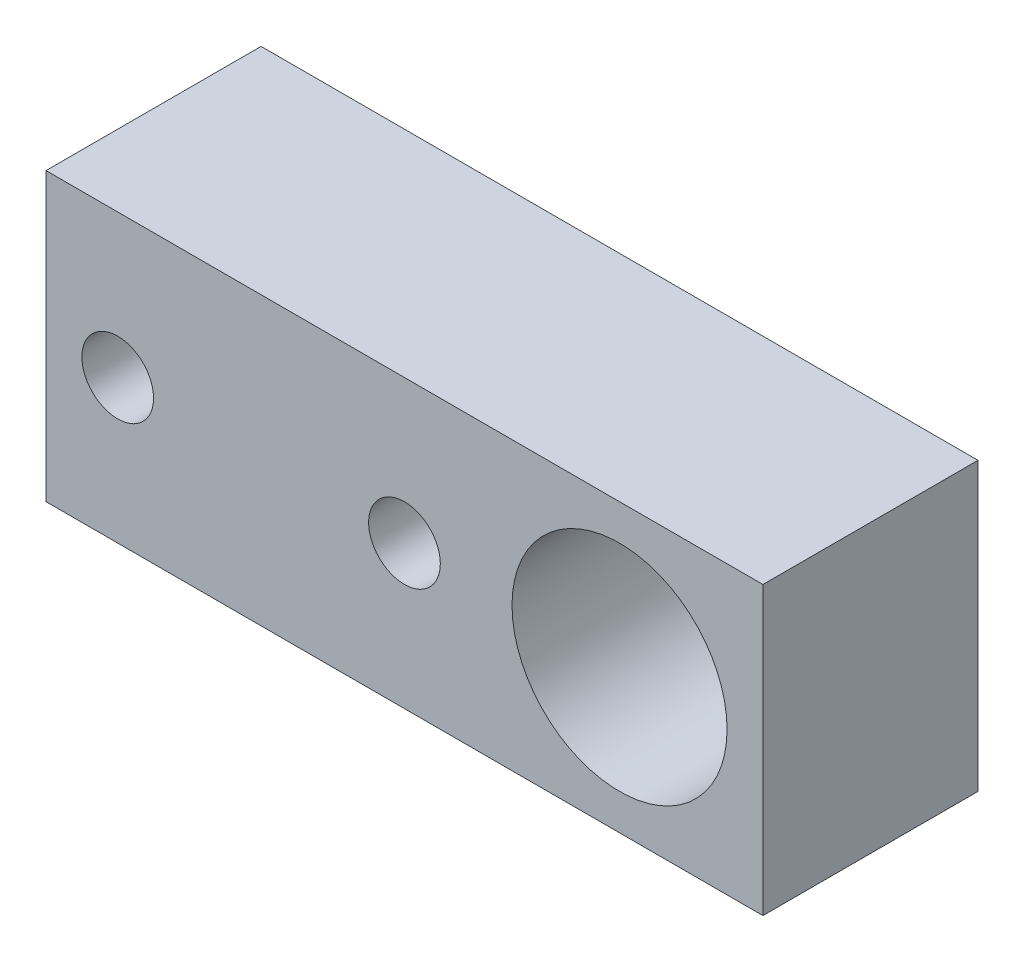
from build123d import *

# Parameters (mm, degrees)
SKETCH1_W               = 15
SKETCH1_H               = 20
BOSS_EXTRUDE1_DEPTH     = 25
CUT_EXTRUDE1_DEPTH      = 31.822070015
CUT_EXTRUDE1_DEPTH_BACK = 31.822070015
SKETCH2_R               = 7.5
M6_TAPPED_HOLE1_D       = 5


with BuildPart() as part:
    # Sketch1 → Boss-Extrude1 (new, symmetric)
    with BuildSketch(Plane(origin=(0, 0, 0), x_dir=(0, 0, -1), z_dir=(1, 0, 0))):
        Rectangle(SKETCH1_W, SKETCH1_H)
    extrude(amount=BOSS_EXTRUDE1_DEPTH, both=True)

    # Sketch2 → Cut-Extrude1 (cut, two sides: drawn at the far end of the back side and taken through both)
    with BuildSketch(Plane.XY.offset(7.5).offset(-CUT_EXTRUDE1_DEPTH_BACK)):
        with Locations((15, 0)):
            Circle(SKETCH2_R)
    extrude(amount=CUT_EXTRUDE1_DEPTH + CUT_EXTRUDE1_DEPTH_BACK, mode=Mode.SUBTRACT)

    # M6 Tapped Hole1 (through all)
    with Locations(Plane.XY.offset(7.5)):
        with Locations((0, 0), (-20, 0)):
            Hole(M6_TAPPED_HOLE1_D / 2)


solid = part.part
